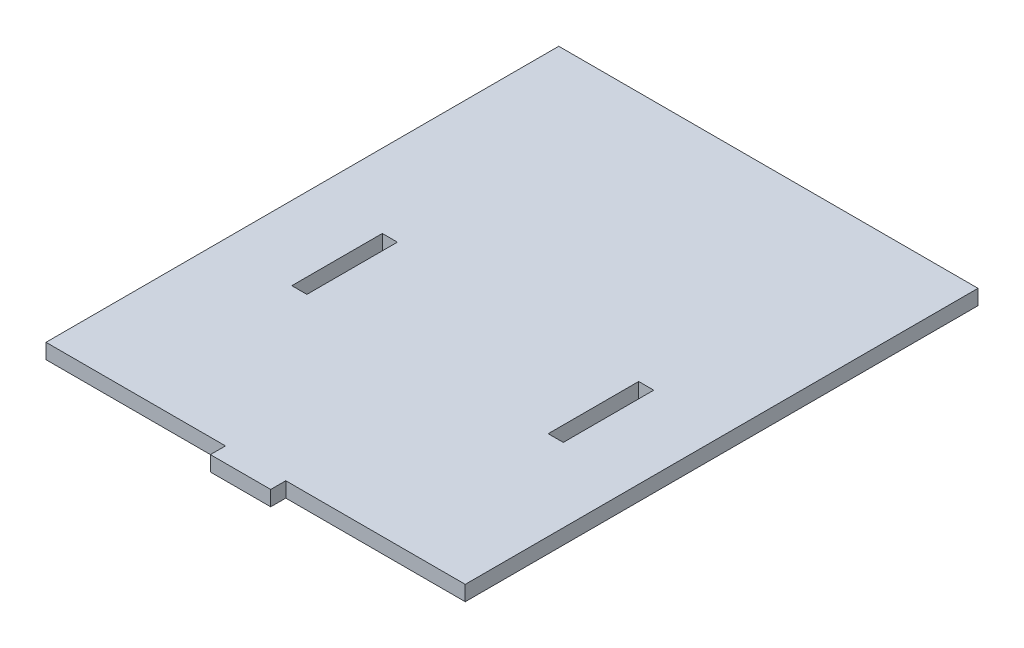
from build123d import *

# Parameters (mm, degrees)
SKETCH1_W           = 5
SKETCH1_H           = 30
SKETCH1_W_2         = 20
SKETCH1_H_2         = 5
BOSS_EXTRUDE1_DEPTH = 5


with BuildPart() as part:
    # Sketch1 → Boss-Extrude1 (new body)
    # profile 1 of 2: a face of its own
    with BuildSketch(Plane(origin=(0, 0, 0), x_dir=(1, 0, 0), z_dir=(0, 1, 0))):
        Polygon((69.5, -72), (69.5, 98), (61.25, 98), (-61.25, 98), (-69.5, 98), (-69.5, -72), (-45, -72), (-10, -72), (10, -72), (45, -72), align=None)
        with Locations((42.5, 0)):
            Rectangle(SKETCH1_W, SKETCH1_H, mode=Mode.SUBTRACT)
        with Locations((-42.5, 0)):
            Rectangle(SKETCH1_W, SKETCH1_H, mode=Mode.SUBTRACT)
    # profile 2 of 2: a face of its own
    with BuildSketch(Plane(origin=(0, 0, 0), x_dir=(1, 0, 0), z_dir=(0, 1, 0))):
        with Locations((0, -74.5)):
            Rectangle(SKETCH1_W_2, SKETCH1_H_2)
    extrude(amount=BOSS_EXTRUDE1_DEPTH)


solid = part.part
